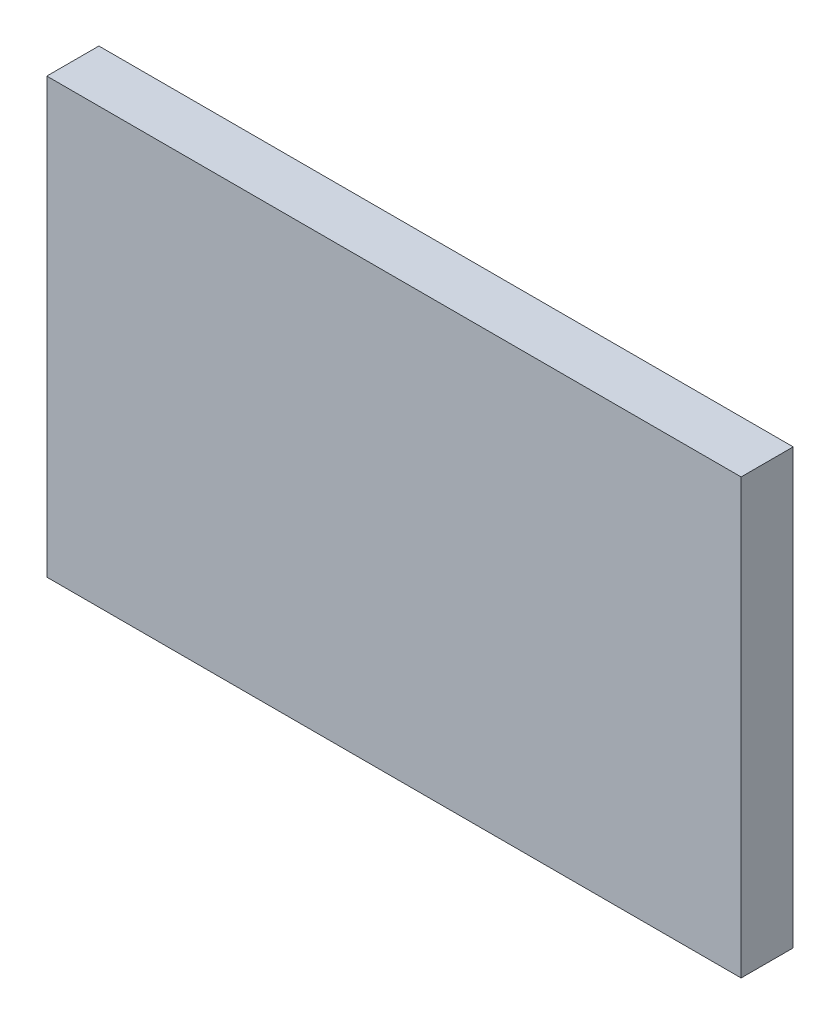
from build123d import *

# Parameters (mm, degrees)
SKETCH1_W           = 80
SKETCH1_H           = 50
BOSS_EXTRUDE1_DEPTH = 6


with BuildPart() as part:
    # Sketch1 → Boss-Extrude1 (new body)
    with BuildSketch(Plane.XY):
        Rectangle(SKETCH1_W, SKETCH1_H)
    extrude(amount=BOSS_EXTRUDE1_DEPTH)


solid = part.part
